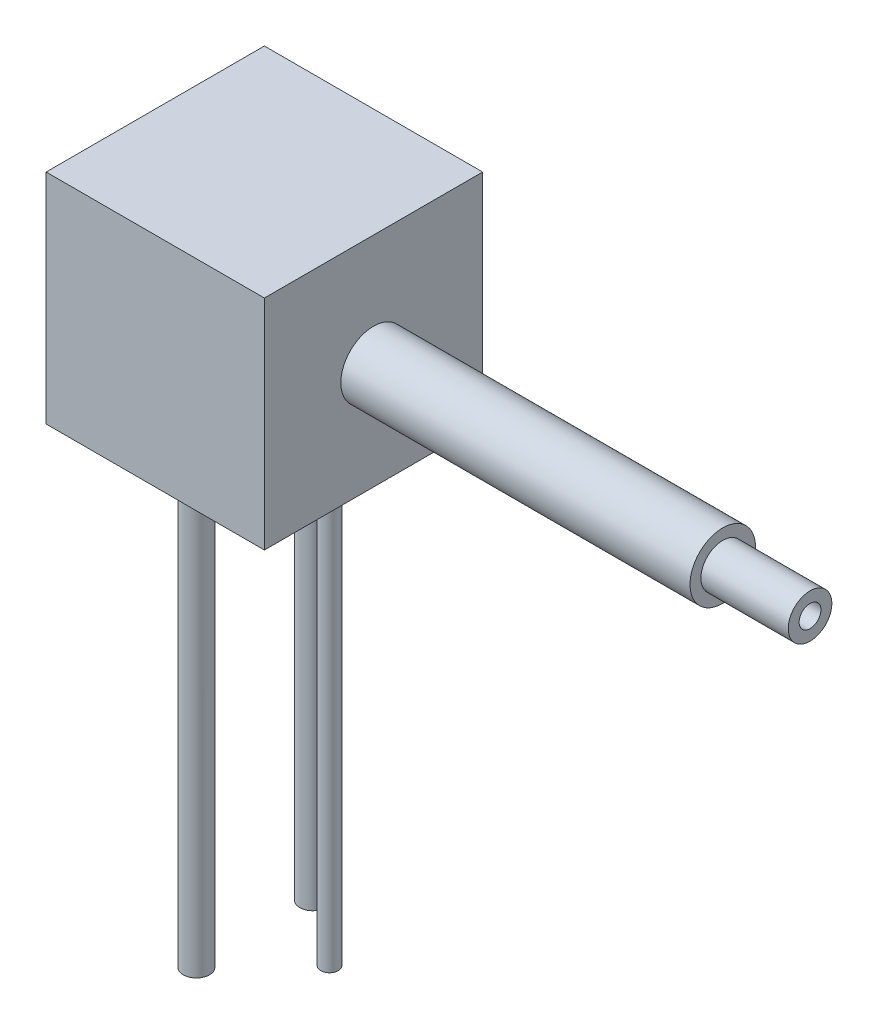
from build123d import *

# Parameters (mm, degrees)
SKETCH1_W           = 500
SKETCH1_H           = 500
BOSS_EXTRUDE1_DEPTH = 500
SKETCH2_R           = 30
SKETCH2_R_2         = 20
BOSS_EXTRUDE2_DEPTH = 1000
SKETCH3_R           = 75
BOSS_EXTRUDE3_DEPTH = 800
SKETCH4_R           = 50
BOSS_EXTRUDE4_DEPTH = 200
SKETCH5_R           = 25
CUT_EXTRUDE1_DEPTH  = 1200
SKETCH6_R           = 15
SKETCH6_R_2         = 10
CUT_EXTRUDE2_DEPTH  = 200


with BuildPart() as part:
    # Sketch1 → Boss-Extrude1 (new body)
    with BuildSketch(Plane(origin=(0, 0, 0), x_dir=(1, 0, 0), z_dir=(0, 1, 0))):
        Rectangle(SKETCH1_W, SKETCH1_H)
    extrude(amount=BOSS_EXTRUDE1_DEPTH)

    # Sketch2 → Boss-Extrude2 (add)
    with BuildSketch(Plane.XZ):
        with Locations(Location((0, 155.7539011, 0), (0, 0, 90))):
            Circle(SKETCH2_R)
        with Locations(Location((-149.221176771, 0, 0), (0, 0, 90))):
            Circle(SKETCH2_R_2)
        with Locations(Location((149.221176771, 0, 0), (0, 0, 90))):
            Circle(SKETCH2_R_2)
        with Locations(Location((0, -111.056313588, 0), (0, 0, 90))):
            Circle(SKETCH2_R)
    extrude(amount=BOSS_EXTRUDE2_DEPTH)

    # Sketch3 → Boss-Extrude3 (add)
    with BuildSketch(Plane(origin=(250, 0, 0), x_dir=(0, 0, -1), z_dir=(1, 0, 0))):
        with Locations((0, 244.080255808)):
            Circle(SKETCH3_R)
    extrude(amount=BOSS_EXTRUDE3_DEPTH)

    # Sketch4 → Boss-Extrude4 (add)
    with BuildSketch(Plane(origin=(1050, 0, 0), x_dir=(0, 0, -1), z_dir=(1, 0, 0))):
        with Locations((0, 244.080255808)):
            Circle(SKETCH4_R)
    extrude(amount=BOSS_EXTRUDE4_DEPTH)

    # Sketch5 → Cut-Extrude1 (cut)
    with BuildSketch(Plane(origin=(1250, 0, 0), x_dir=(0, 0, -1), z_dir=(1, 0, 0))):
        with Locations((0, 244.080255808)):
            Circle(SKETCH5_R)
    extrude(amount=-CUT_EXTRUDE1_DEPTH, mode=Mode.SUBTRACT)

    # Sketch6 → Cut-Extrude2 (cut)
    with BuildSketch(Plane.XZ.offset(1000)):
        with Locations(Location((0, 155.7539011, 0), (0, 0, 270))):
            Circle(SKETCH6_R)
        with Locations(Location((149.221176771, 0, 0), (0, 0, 270))):
            Circle(SKETCH6_R_2)
        with Locations(Location((0, -111.056313588, 0), (0, 0, 270))):
            Circle(SKETCH6_R)
        with Locations(Location((-149.221176771, 0, 0), (0, 0, 270))):
            Circle(SKETCH6_R_2)
    extrude(amount=-CUT_EXTRUDE2_DEPTH, mode=Mode.SUBTRACT)


solid = part.part
